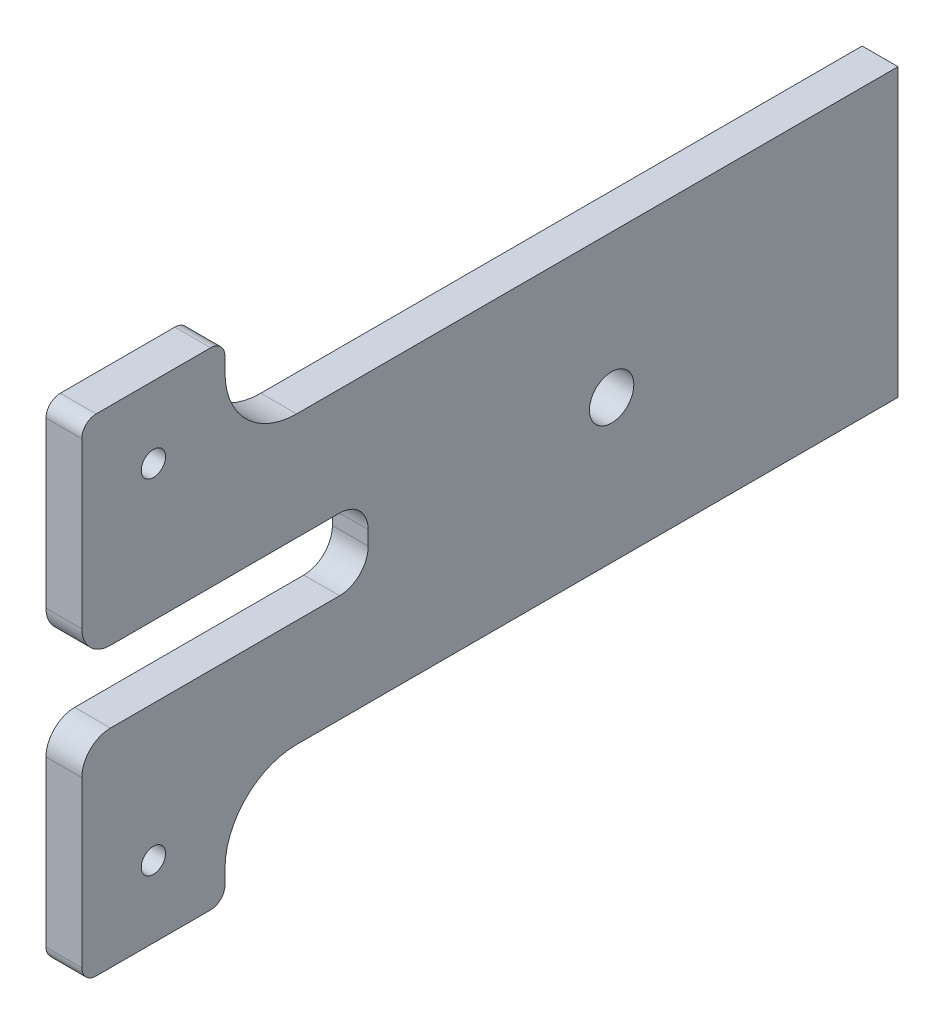
from build123d import *

# Parameters (mm, degrees)
SKETCH2_R           = 3.1
SKETCH2_R_2         = 1.7
BOSS_EXTRUDE1_DEPTH = 5
FILLET1_R           = 10
FILLET2_R           = 2
SKETCH3_W           = 10
SKETCH3_H           = 40
CUT_EXTRUDE1_DEPTH  = 5
FILLET3_R           = 4


with BuildPart() as part:
    # Sketch2 → Boss-Extrude1 (new body)
    with BuildSketch(Plane.YZ):
        Polygon((-20, 0), (-20, 94), (-34, 94), (-34, 114), (34, 114), (34, 94), (20, 94), (20, 0), align=None)
        with Locations(Location((0, 40, 0), (0, 0, 270))):
            Circle(SKETCH2_R, mode=Mode.SUBTRACT)
        with Locations(Location((-24, 104, 0), (0, 0, 270))):
            Circle(SKETCH2_R_2, mode=Mode.SUBTRACT)
        with Locations(Location((24, 104, 0), (0, 0, 270))):
            Circle(SKETCH2_R_2, mode=Mode.SUBTRACT)
    extrude(amount=BOSS_EXTRUDE1_DEPTH)

    # Fillet1
    fillet1_edges = [part.edges().sort_by_distance(p)[0] for p in [
        (2.5, -20, 94),
        (2.5, 20, 94),
    ]]
    fillet(fillet1_edges, radius=FILLET1_R)

    # Fillet2
    fillet2_edges = [part.edges().sort_by_distance(p)[0] for p in [
        (2.5, -34, 94),
        (2.5, -34, 114),
        (2.5, 34, 114),
        (2.5, 34, 94),
    ]]
    fillet(fillet2_edges, radius=FILLET2_R)

    # Sketch3 → Cut-Extrude1 (cut)
    with BuildSketch(Plane(origin=(0, 0, 0), x_dir=(0, -1, 0), z_dir=(-1, 0, 0))):
        with Locations((0, 94)):
            Rectangle(SKETCH3_W, SKETCH3_H)
    extrude(amount=-CUT_EXTRUDE1_DEPTH, mode=Mode.SUBTRACT)

    # Fillet3
    fillet3_edges = [part.edges().sort_by_distance(p)[0] for p in [
        (2.5, 5, 74),
        (2.5, 5, 114),
        (2.5, -5, 114),
        (2.5, -5, 74),
    ]]
    fillet(fillet3_edges, radius=FILLET3_R)


solid = part.part
